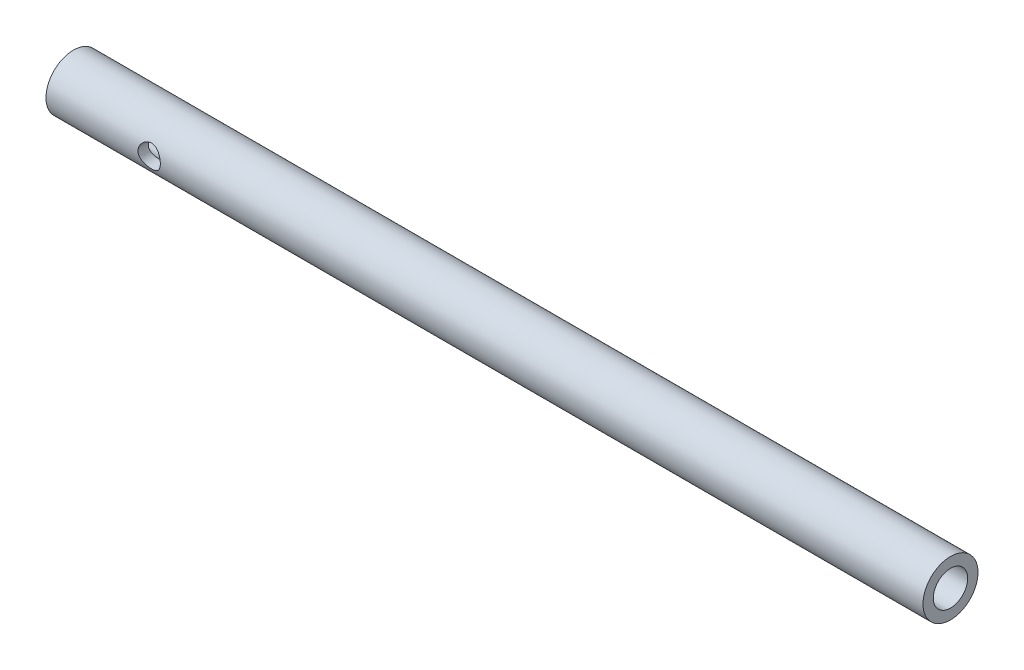
from build123d import *

# Parameters (mm, degrees)
SKETCH1_R           = 16
SKETCH1_R_2         = 10
BOSS_EXTRUDE1_DEPTH = 510
SKETCH2_R           = 6.5
CUT_EXTRUDE1_DEPTH  = 29.5


with BuildPart() as part:
    # Sketch1 → Boss-Extrude1 (new body)
    with BuildSketch(Plane(origin=(0, 0, 0), x_dir=(0, 0, -1), z_dir=(1, 0, 0))):
        Circle(SKETCH1_R)
        Circle(SKETCH1_R_2, mode=Mode.SUBTRACT)
    extrude(amount=-BOSS_EXTRUDE1_DEPTH)

    # Sketch2 → Cut-Extrude1 (cut, symmetric)
    with BuildSketch(Plane.XY):
        with Locations((-450, 0)):
            Circle(SKETCH2_R)
    extrude(amount=CUT_EXTRUDE1_DEPTH, both=True, mode=Mode.SUBTRACT)


solid = part.part
